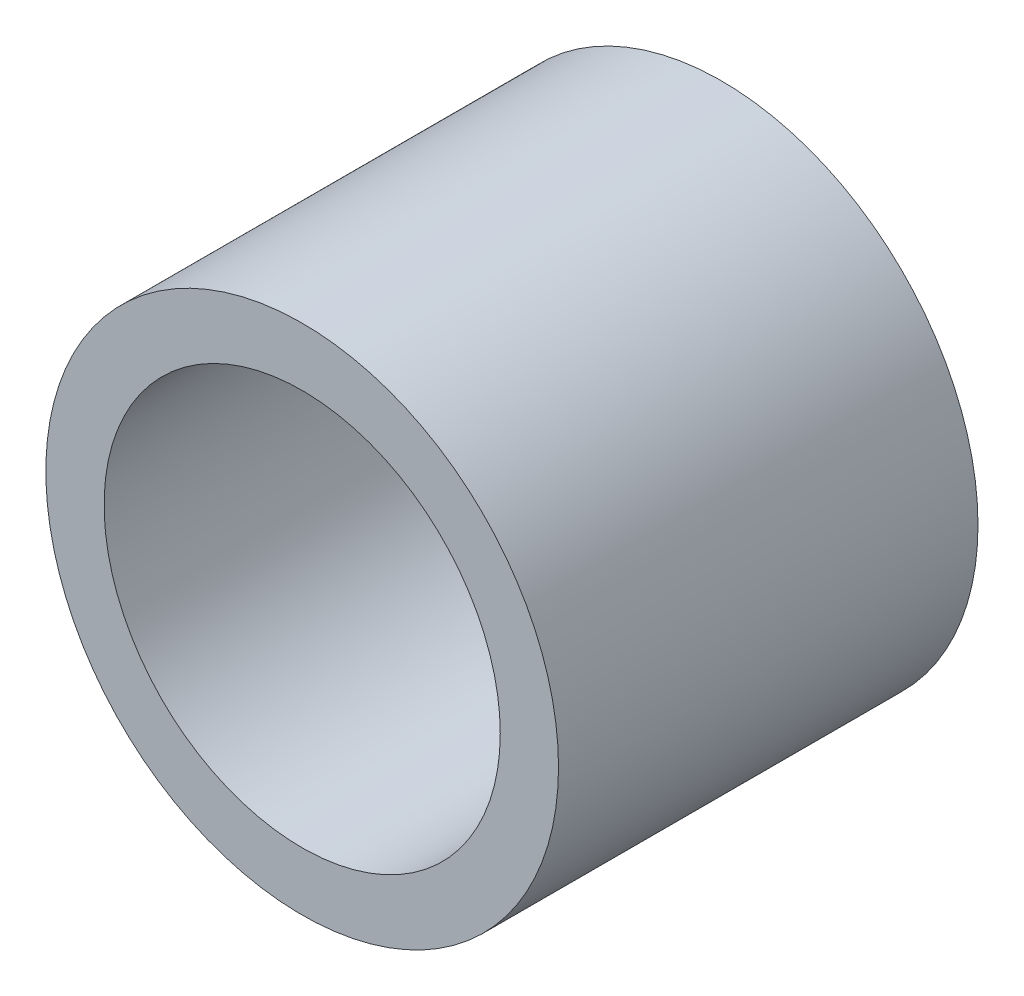
from build123d import *

# Parameters (mm, degrees)
CROQUIS1_R              = 5.5
CROQUIS1_R_2            = 4.25
SALIENTE_EXTRUIR1_DEPTH = 9


with BuildPart() as part:
    # Croquis1 → Saliente-Extruir1 (new body)
    with BuildSketch(Plane.XY):
        Circle(CROQUIS1_R)
        Circle(CROQUIS1_R_2, mode=Mode.SUBTRACT)
    extrude(amount=SALIENTE_EXTRUIR1_DEPTH)


solid = part.part
